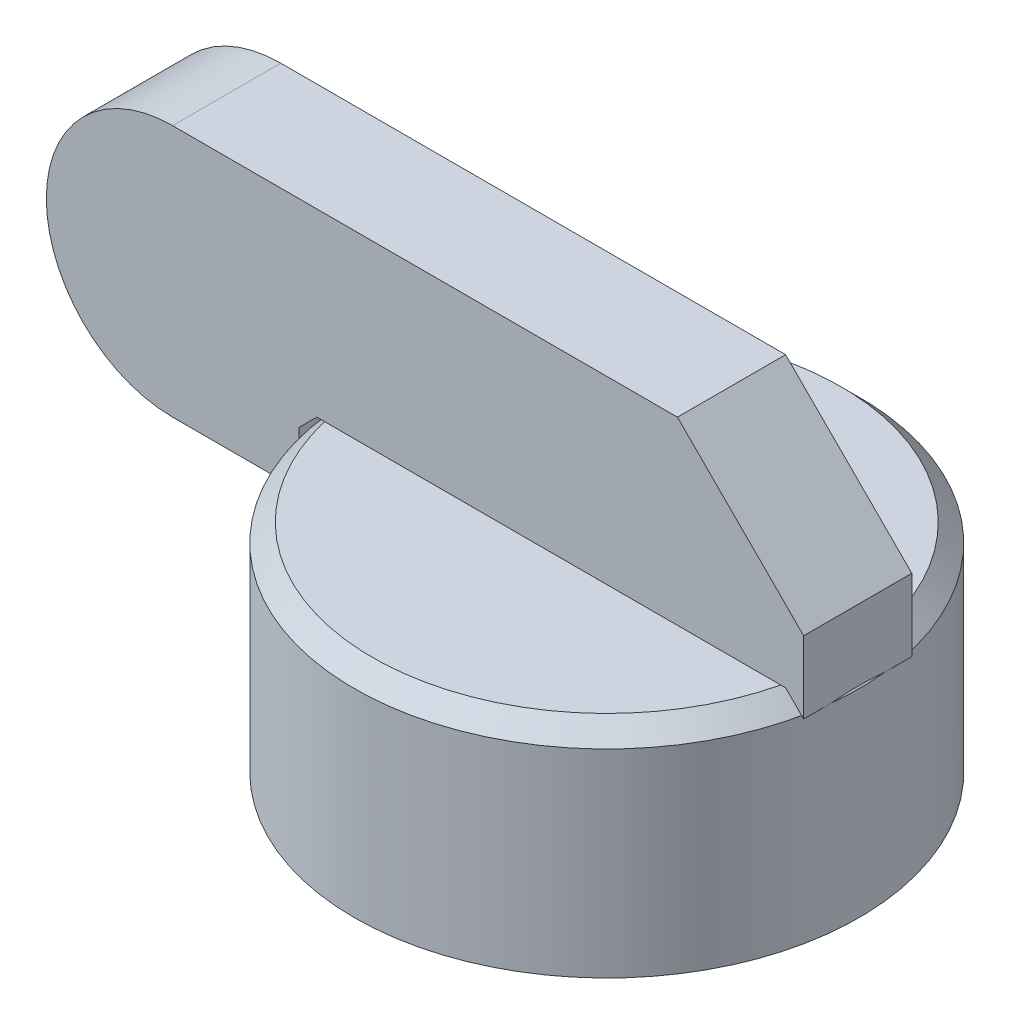
from build123d import *

# Parameters (mm, degrees)
SKETCH1_R            = 11.1125
BOSS_EXTRUDE1_DEPTH  = 9.525
CHAMFER1_SIZE        = 0.79375
BOSS_EXTRUDE30_DEPTH = 2.38125


with BuildPart() as part:
    # Sketch1 → Boss-Extrude1 (new body)
    with BuildSketch(Plane(origin=(0, 0, 0), x_dir=(1, 0, 0), z_dir=(0, 1, 0))):
        with Locations(Location((0, 0, 0), (0, 0, 90))):
            Circle(SKETCH1_R)
    extrude(amount=BOSS_EXTRUDE1_DEPTH)

    # Chamfer1
    chamfer1_edges = [part.edges().sort_by_distance(p)[0] for p in [
        (0, 9.525, 11.1125),
    ]]
    chamfer(chamfer1_edges, length=CHAMFER1_SIZE)

    # Sketch2 → Boss-Extrude30 (add, symmetric)
    with BuildSketch(Plane.XY):
        with BuildLine():
            Line((11.049, 8.73125), (11.049, 11.90625))
            Line((11.049, 11.90625), (5.49275, 17.4625))
            Line((5.49275, 17.4625), (-16.73225, 17.4625))
            ThreePointArc((-16.73225, 17.4625), (-22.2885, 11.90625), (-16.73225, 6.35))
            Line((-16.73225, 6.35), (-11.176, 6.35))
            Line((-11.176, 6.35), (-11.176, 8.73125))
            Line((-11.176, 8.73125), (-10.38225, 9.525))
            Line((-10.38225, 9.525), (10.25525, 9.525))
            Line((10.25525, 9.525), (11.049, 8.73125))
        make_face()
    extrude(amount=BOSS_EXTRUDE30_DEPTH, both=True)


solid = part.part
